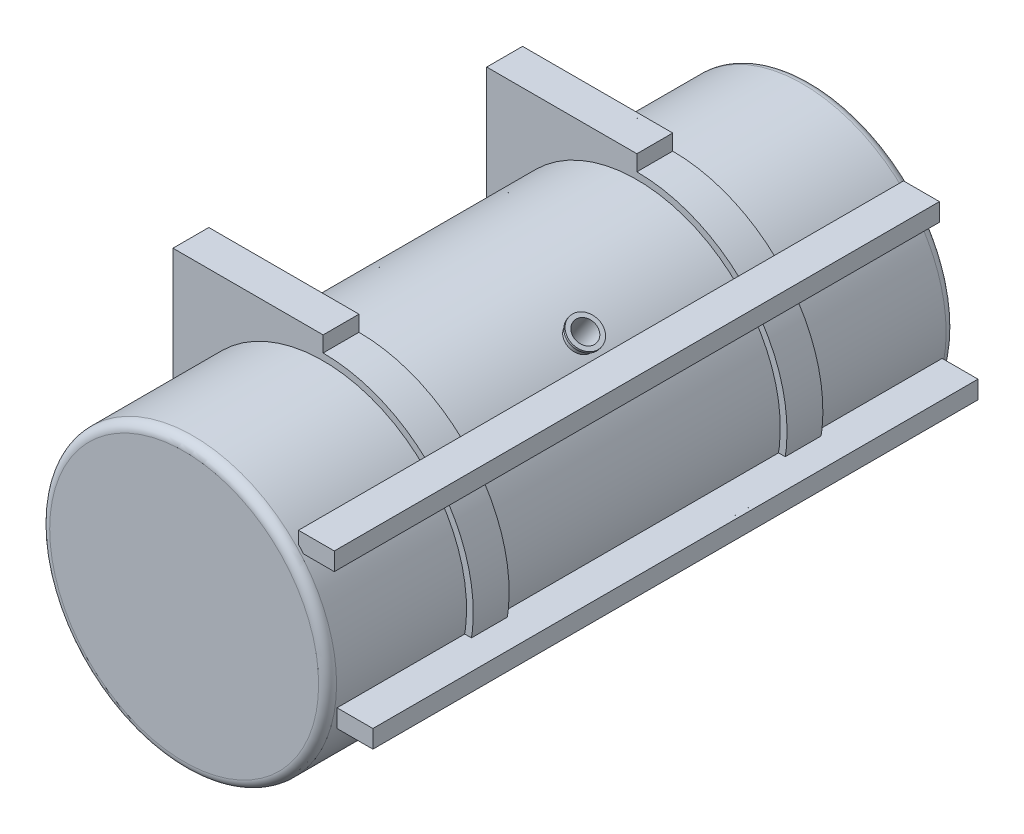
from build123d import *
from build123d.topology import SkipClean

# Parameters (mm, degrees)
SKETCH1_R           = 320
SKETCH1_R_2         = 310
BOSS_EXTRUDE1_DEPTH = 700
SKETCH2_R           = 320
BOSS_EXTRUDE2_DEPTH = 10
FILLET1_R           = 20
FILLET2_R           = 20
SKETCH3_W           = 80
SKETCH3_H           = 40
BOSS_EXTRUDE3_DEPTH = 675
SKETCH4_R           = 320
BOSS_EXTRUDE4_DEPTH = 40
CUT_EXTRUDE1_DEPTH  = 30


with BuildPart() as part:
    # Sketch1 → Boss-Extrude1 (new, symmetric)
    with BuildSketch(Plane.XY):
        Circle(SKETCH1_R)
        Circle(SKETCH1_R_2, mode=Mode.SUBTRACT)
    extrude(amount=BOSS_EXTRUDE1_DEPTH, both=True)

    # Sketch2 → Boss-Extrude2 (add)
    with BuildSketch(Plane.XY.offset(700)):
        Circle(SKETCH2_R)
    boss_extrude2 = extrude(amount=-BOSS_EXTRUDE2_DEPTH)

    # Fillet1
    fillet1_edges = [part.edges().sort_by_distance(p)[0] for p in [
        (-320, 0, 700),
        (-310, 0, 690),
    ]]
    fillet(fillet1_edges, radius=FILLET1_R)

    # Mirror1: Boss-Extrude2 across plane
    add(boss_extrude2.mirror(Plane.XY))

    # Fillet2
    fillet2_edges = [part.edges().sort_by_distance(p)[0] for p in [
        (-320, 0, -700),
        (-310, 0, -690),
    ]]
    fillet(fillet2_edges, radius=FILLET2_R)

    # Sketch3 → Boss-Extrude3 (add, symmetric)
    with BuildSketch(Plane.XY):
        with Locations((270, 230)):
            Rectangle(SKETCH3_W, SKETCH3_H)
        with Locations((356.069612586, -70)):
            Rectangle(SKETCH3_W, SKETCH3_H)
    extrude(amount=BOSS_EXTRUDE3_DEPTH, both=True)


with BuildPart() as boss_extrude3_piece_1:
    # of the separate pieces the step leaves, piece 1, a body of its own (boss_extrude3_pieces)
    add(part.part.solids().sort_by_distance((320, 0, -680))[0])

    # Sketch4 → Boss-Extrude4 (add, symmetric)
    with BuildSketch(Plane.XY.offset(350)):
        with BuildLine():
            Line((-335, 0), (-335, 370))
            Line((-335, 370), (0, 370))
            Line((0, 370), (0, 335))
            ThreePointArc((0, 335), (144.697961285, 302.138213406), (261.007662723, 210))
            Line((261.007662723, 210), (300, 210))
            Line((300, 210), (280, 183.915741577))
            ThreePointArc((280, 183.915741577), (331.005251033, 51.580265493), (322.684056005, -90))
            Line((322.684056005, -90), (386.069612586, -90))
            Line((386.069612586, -90), (299.541316015, -150))
            ThreePointArc((299.541316015, -150), (-77.067045924, -326.014831614), (-335, 0))
        make_face()
        Circle(SKETCH4_R, mode=Mode.SUBTRACT)
    boss_extrude4 = extrude(amount=BOSS_EXTRUDE4_DEPTH, both=True)

    # Sketch7 → Cut-Extrude1 (cut, symmetric)
    with SkipClean():  # the faces are left unmerged after this step: merging them gives an invalid solid
        with BuildSketch(Plane.XY.offset(350)):
            with BuildLine():
                Line((-335, 360), (-10, 360))
                Line((-10, 360), (-10, 334.850713005))
                ThreePointArc((-10, 334.850713005), (-240.390307625, 233.318451906), (-335, 0))
                Line((-335, 0), (-335, 360))
            make_face()
        cut_extrude1 = extrude(amount=CUT_EXTRUDE1_DEPTH, both=True, mode=Mode.SUBTRACT)

    # Mirror2: Boss-Extrude4 across plane
    with SkipClean():  # the faces are left unmerged after this step: merging them gives an invalid solid
        add(boss_extrude4.mirror(Plane.XY))

    # Mirror2 2: Cut-Extrude1 across plane
    with SkipClean():  # the faces are left unmerged after this step: merging them gives an invalid solid
        add(cut_extrude1.mirror(Plane.XY), mode=Mode.SUBTRACT)

    # Sketch5 → Cut-Revolve1 (revolve, cut)
    with SkipClean():  # the faces are left unmerged after this step: merging them gives an invalid solid
        with BuildSketch(Plane.XY):
            Polygon((174.537187252, 292.851105967), (132.292314558, 232.519175234), (152.771115666, 218.179764326), (195.015988359, 278.511695058), align=None)
        revolve(axis=Axis((0, 0, 0), (0.5735764363510472, 0.8191520442889911, 0)), mode=Mode.SUBTRACT)

    # Sketch5<3> → Revolve1 (revolve)
    with SkipClean():  # the faces are left unmerged after this step: merging them gives an invalid solid
        with BuildSketch(Plane.XY):
            Polygon((128.196554337, 235.387057416), (132.292314558, 232.519175234), (174.537187252, 292.851105967), (170.441427031, 295.718988149), (166.345666809, 298.586870331), (163.477784627, 294.491110109), (167.573544849, 291.623227927), align=None)
        revolve(axis=Axis((0, 0, 0), (0.5735764363510472, 0.8191520442889911, 0)))


with BuildPart() as boss_extrude3_piece_2:
    # of the separate pieces the step leaves, piece 2, a body of its own (boss_extrude3_pieces)
    add(part.part.solids().sort_by_distance((316.069612586, -90, -675))[0])


solid = Compound([boss_extrude3_piece_1.part, boss_extrude3_piece_2.part])
